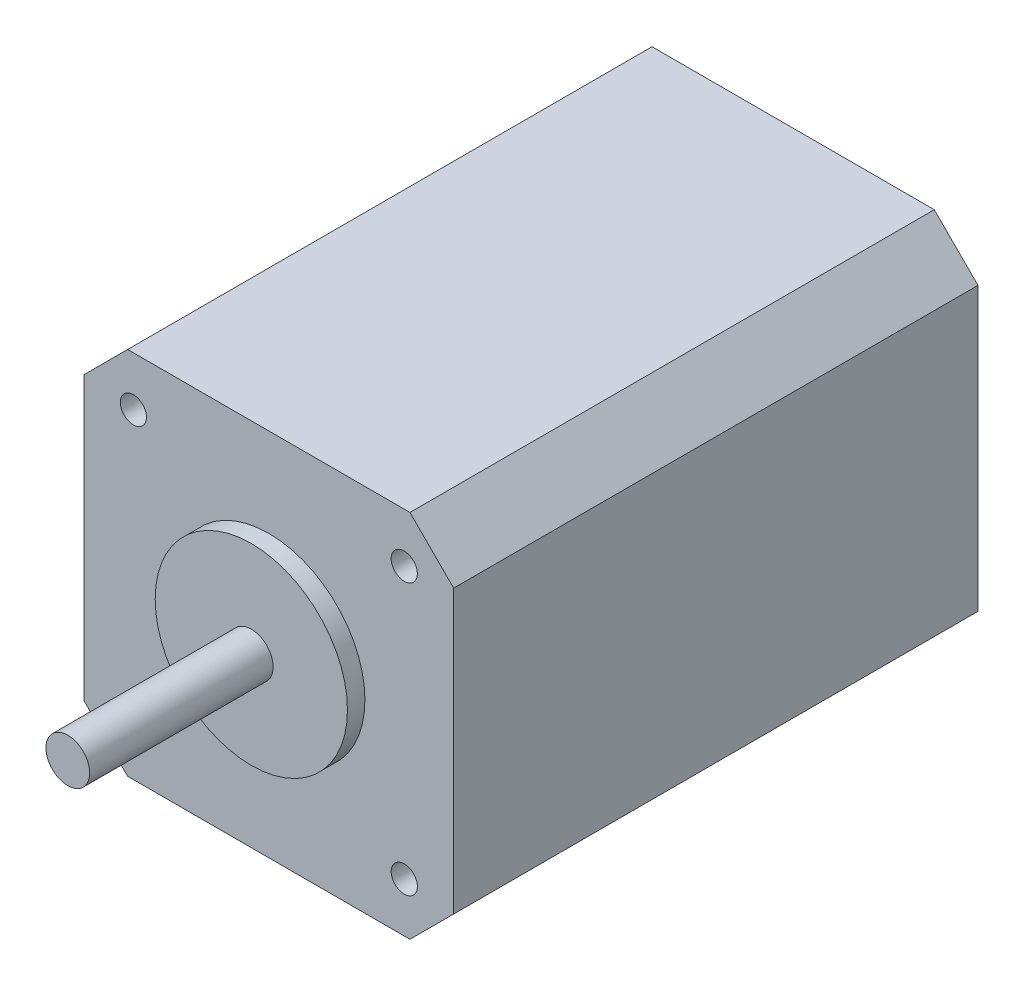
from build123d import *

# Parameters (mm, degrees)
CROQUIS1_W              = 42.3
CROQUIS1_H              = 42.3
CROQUIS1_R              = 1.5
SALIENTE_EXTRUIR1_DEPTH = 30
CROQUIS2_R              = 11
SALIENTE_EXTRUIR2_DEPTH = 2
CROQUIS3_R              = 2.5
SALIENTE_EXTRUIR3_DEPTH = 23
CHAFL_N1_SIZE           = 5


with BuildPart() as part:
    # Croquis1 → Saliente-Extruir1 (new, symmetric)
    with BuildSketch(Plane.XY):
        Rectangle(CROQUIS1_W, CROQUIS1_H)
        with Locations((-15.5, 15.5)):
            Circle(CROQUIS1_R, mode=Mode.SUBTRACT)
        with Locations((-15.5, -15.5)):
            Circle(CROQUIS1_R, mode=Mode.SUBTRACT)
        with Locations(Location((15.5, -15.5, 0), (0, 0, 180))):
            Circle(CROQUIS1_R, mode=Mode.SUBTRACT)
        with Locations(Location((15.5, 15.5, 0), (0, 0, 180))):
            Circle(CROQUIS1_R, mode=Mode.SUBTRACT)
    extrude(amount=SALIENTE_EXTRUIR1_DEPTH, both=True)

    # Croquis2 → Saliente-Extruir2 (add)
    with BuildSketch(Plane.XY.offset(30)):
        Circle(CROQUIS2_R)
    extrude(amount=SALIENTE_EXTRUIR2_DEPTH)

    # Croquis3 → Saliente-Extruir3 (add)
    with BuildSketch(Plane.XY.offset(30)):
        Circle(CROQUIS3_R)
    extrude(amount=SALIENTE_EXTRUIR3_DEPTH)

    # Chaflán1
    chafl_n1_edges = [part.edges().sort_by_distance(p)[0] for p in [
        (-21.15, 21.15, 0),
        (21.15, 21.15, 0),
        (21.15, -21.15, 0),
        (-21.15, -21.15, 0),
    ]]
    chamfer(chafl_n1_edges, length=CHAFL_N1_SIZE)


solid = part.part
